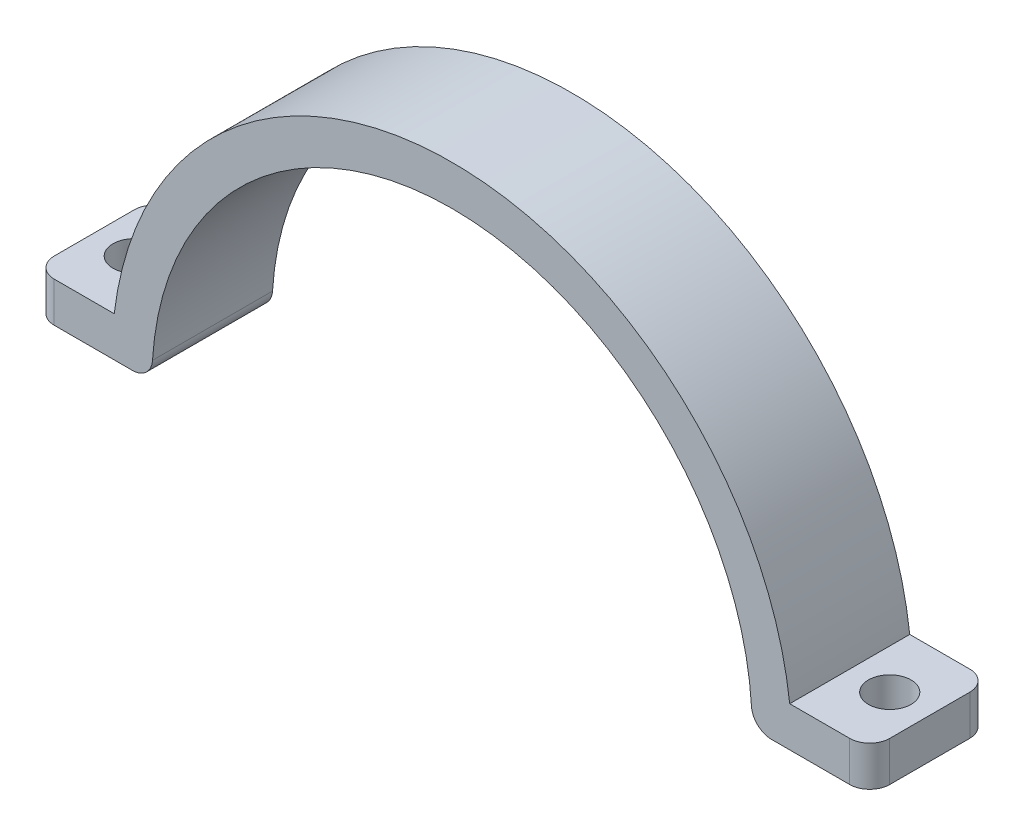
from build123d import *

# Parameters (mm, degrees)
BOSS_EXTRUDE1_DEPTH = 9.525
CUT_EXTRUDE1_REACH  = 84.186
SKETCH3_R           = 3.3782
FILLET1_R           = 3.175


with BuildPart() as part:
    # Sketch2 → Boss-Extrude1 (new, symmetric)
    with BuildSketch(Plane.XY):
        with BuildLine():
            Line((47.625, 0), (66.300169076, 0))
            Line((66.300169076, 0), (66.300169076, 6.35))
            Line((66.300169076, 6.35), (53.600169076, 6.35))
            ThreePointArc((53.600169076, 6.35), (0, 53.975), (-53.600169076, 6.35))
            Line((-53.600169076, 6.35), (-66.300169076, 6.35))
            Line((-66.300169076, 6.35), (-66.300169076, 0))
            Line((-66.300169076, 0), (-47.625, 0))
            ThreePointArc((-47.625, 0), (0, 47.625), (47.625, 0))
        make_face()
    extrude(amount=BOSS_EXTRUDE1_DEPTH, both=True)

    # Sketch3 → Cut-Extrude1 (cut, up to next)
    with BuildSketch(Plane(origin=(0, 6.35, 0), x_dir=(1, 0, 0), z_dir=(0, 1, 0)), mode=Mode.PRIVATE) as cut_extrude1_sk1:
        with Locations(Location((59.950169076, 0, 0), (0, 0, 180))):
            Circle(SKETCH3_R)
    cut_extrude1_tool1 = extrude(cut_extrude1_sk1.sketch, amount=-CUT_EXTRUDE1_REACH, mode=Mode.PRIVATE) & part.part
    # Sketch3 → Cut-Extrude1 (cut, up to next)
    with BuildSketch(Plane(origin=(0, 6.35, 0), x_dir=(1, 0, 0), z_dir=(0, 1, 0)), mode=Mode.PRIVATE) as cut_extrude1_sk2:
        with Locations(Location((-59.950169076, 0, 0), (0, 0, 270))):
            Circle(SKETCH3_R)
    cut_extrude1_tool2 = extrude(cut_extrude1_sk2.sketch, amount=-CUT_EXTRUDE1_REACH, mode=Mode.PRIVATE) & part.part
    add(cut_extrude1_tool1.solids().sort_by_distance((59.950169, 6.35, 0))[0], mode=Mode.SUBTRACT)
    add(cut_extrude1_tool2.solids().sort_by_distance((-59.950169, 6.35, 0))[0], mode=Mode.SUBTRACT)

    # Fillet1
    fillet1_edges = [part.edges().sort_by_distance(p)[0] for p in [
        (66.300169076, 3.175, -9.525),
        (66.300169076, 3.175, 9.525),
        (-47.625, 0, 0),
        (47.625, 0, 0),
        (-66.300169076, 3.175, 9.525),
        (-66.300169076, 3.175, -9.525),
    ]]
    fillet(fillet1_edges, radius=FILLET1_R)


solid = part.part
